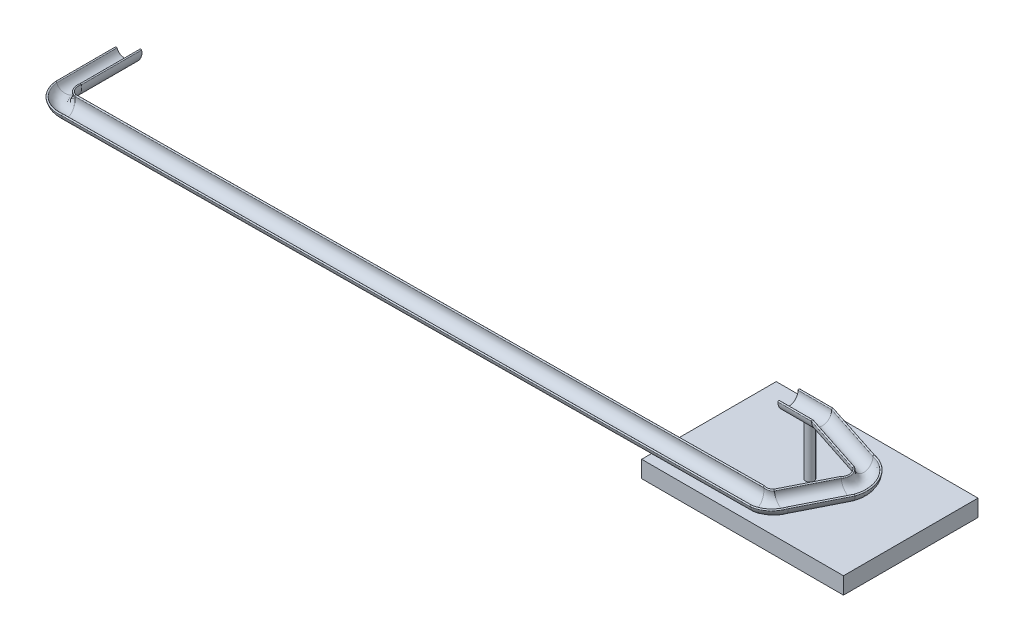
from build123d import *

# Parameters (mm, degrees)
SKETCH_1_W      = 120
SKETCH_1_H      = 80
EXTRUDE_1_DEPTH = 10
SKETCH_2_R      = 2.5
EXTRUDE_2_DEPTH = 30


with BuildPart() as part:
    # 草圖1 → 填料-伸長1 (new body)
    with BuildSketch(Plane(origin=(0, 0, 0), x_dir=(1, 0, 0), z_dir=(0, 1, 0))):
        Rectangle(SKETCH_1_W, SKETCH_1_H)
    extrude(amount=EXTRUDE_1_DEPTH)

    # 草圖2 → 填料-伸長2 (add)
    with BuildSketch(Plane(origin=(0, 10, 0), x_dir=(1, 0, 0), z_dir=(0, 1, 0))):
        with Locations(Location((0, 0, 0), (0, 0, 270))):
            Circle(SKETCH_2_R)
    extrude(amount=EXTRUDE_2_DEPTH)


with BuildPart() as body_2:
    # 掃出1: sweep along a path in 草圖3
    with BuildLine(Plane.XY) as sweep_1_path:
        Line((-12.5, 41), (7.5, 41))
    # 草圖4 → 掃出1 (sweep)
    with BuildSketch(Plane(origin=(-12.5, 0, 0), x_dir=(0, 0, -1), z_dir=(1, 0, 0))):
        with BuildLine():
            ThreePointArc((-5.5, 46.5), (0, 41), (5.5, 46.5))
            ThreePointArc((5.5, 46.5), (6, 47), (6.5, 46.5))
            ThreePointArc((6.5, 46.5), (0, 40), (-6.5, 46.5))
            ThreePointArc((-6.5, 46.5), (-6, 47), (-5.5, 46.5))
        make_face()
    sweep(path=sweep_1_path.line)

    # 掃出2: sweep along a curve in space
    with BuildLine() as sweep_2_path:
        Line((7.5, 41, 0), (42.401838518, 39.563899431, 10.369122232))
        ThreePointArc((42.401838518, 39.563899431, 10.369122232), (48.928397468, 38.833657208, 16.488978634), (47.881691677, 37.863683506, 25.351564364))
        Line((47.881691677, 37.863683506, 25.351564364), (32.069773811, 35.358255461, 49.233294254))
        ThreePointArc((32.069773811, 35.358255461, 49.233294254), (28.465150667, 35.002314618, 52.515869541), (23.726236743, 34.845653085, 53.704757421))
        Line((23.726236743, 34.845653085, 53.704757421), (-385.877198334, 31.535508386, 53.704757421))
        ThreePointArc((-385.877198334, 31.535508386, 53.704757421), (-392.948035259, 31.478366548, 50.775825233), (-395.87687181, 31.454697623, 43.704757421))
        Line((-395.87687181, 31.454697623, 43.704757421), (-395.87687181, 31.454697623, 7.923107717))
    # 草圖5 → 掃出2 (sweep)
    with BuildSketch(Plane(origin=(7.5, 0, 0), x_dir=(0, 0, -1), z_dir=(1, 0, 0))):
        with BuildLine():
            ThreePointArc((-5.5, 46.5), (0, 41), (5.5, 46.5))
            ThreePointArc((5.5, 46.5), (6, 47), (6.5, 46.5))
            ThreePointArc((6.5, 46.5), (0, 40), (-6.5, 46.5))
            ThreePointArc((-6.5, 46.5), (-6, 47), (-5.5, 46.5))
        make_face()
    sweep(path=sweep_2_path.line)


solid = Compound([part.part, body_2.part])
